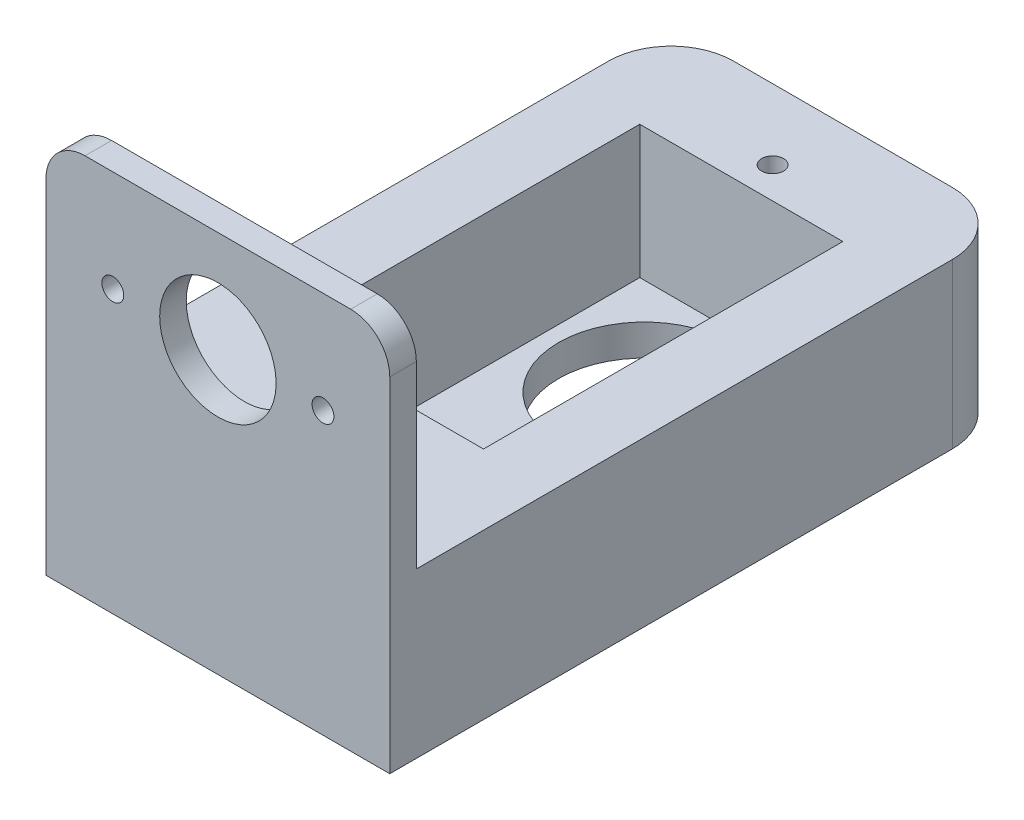
from build123d import *

# Parameters (mm, degrees)
SKETCH1_W           = 22
SKETCH1_H           = 40
BOSS_EXTRUDE1_DEPTH = 10.5
SKETCH2_W           = 13
SKETCH2_H           = 23
CUT_EXTRUDE1_DEPTH  = 8.5
SKETCH3_R           = 5.5
CUT_EXTRUDE2_DEPTH  = 47.435439053
SKETCH4_W           = 22
SKETCH4_H           = 1.7
BOSS_EXTRUDE2_DEPTH = 14
SKETCH5_R           = 3.725
CUT_EXTRUDE3_DEPTH  = 51.508811113
SKETCH5_3_R         = 3.725
SKETCH5_3_R_2       = 0.7
CUT_EXTRUDE4_DEPTH  = 10
SKETCH6_R           = 0.7
CUT_EXTRUDE5_DEPTH  = 2.5
FILLET1_R           = 4
FILLET2_R           = 2.5


with BuildPart() as part:
    # Sketch1 → Boss-Extrude1 (new body)
    with BuildSketch(Plane(origin=(0, 0, 0), x_dir=(1, 0, 0), z_dir=(0, 1, 0))):
        with Locations((11, 20)):
            Rectangle(SKETCH1_W, SKETCH1_H)
    extrude(amount=BOSS_EXTRUDE1_DEPTH)

    # Sketch2 → Cut-Extrude1 (cut)
    with BuildSketch(Plane(origin=(0, 10.5, 0), x_dir=(1, 0, 0), z_dir=(0, 1, 0))):
        with Locations((11, 22)):
            Rectangle(SKETCH2_W, SKETCH2_H)
    extrude(amount=-CUT_EXTRUDE1_DEPTH, mode=Mode.SUBTRACT)

    # Sketch3 → Cut-Extrude2 (cut, through all)
    with BuildSketch(Plane(origin=(0, 2, 0), x_dir=(1, 0, 0), z_dir=(0, 1, 0))):
        with Locations((11, 27.3)):
            Circle(SKETCH3_R)
    extrude(amount=-CUT_EXTRUDE2_DEPTH, mode=Mode.SUBTRACT)

    # Sketch4 → Boss-Extrude2 (add)
    with BuildSketch(Plane(origin=(0, 10.5, 0), x_dir=(1, 0, 0), z_dir=(0, 1, 0))):
        with Locations((11, 0.85)):
            Rectangle(SKETCH4_W, SKETCH4_H)
    extrude(amount=BOSS_EXTRUDE2_DEPTH)

    # Sketch5 → Cut-Extrude3 (cut, through all)
    with BuildSketch(Plane(origin=(0, 0, -1.7), x_dir=(-1, 0, 0), z_dir=(0, 0, -1))):
        with Locations((-11, 18)):
            Circle(SKETCH5_R)
    extrude(amount=-CUT_EXTRUDE3_DEPTH, mode=Mode.SUBTRACT)

    # Sketch5<3> → Cut-Extrude4 (cut)
    with BuildSketch(Plane(origin=(0, 0, -1.7), x_dir=(-1, 0, 0), z_dir=(0, 0, -1))):
        with Locations((-11, 18)):
            Circle(SKETCH5_3_R)
        with Locations((-17.725, 18)):
            Circle(SKETCH5_3_R_2)
        with Locations((-4.275, 18)):
            Circle(SKETCH5_3_R_2)
    extrude(amount=-CUT_EXTRUDE4_DEPTH, mode=Mode.SUBTRACT)

    # Sketch6 → Cut-Extrude5 (cut)
    with BuildSketch(Plane(origin=(0, 10.5, 0), x_dir=(1, 0, 0), z_dir=(0, 1, 0))):
        with Locations((11, 35.5)):
            Circle(SKETCH6_R)
        with Locations((11, 7.5)):
            Circle(SKETCH6_R)
    extrude(amount=-CUT_EXTRUDE5_DEPTH, mode=Mode.SUBTRACT)

    # Fillet1
    fillet1_edges = [part.edges().sort_by_distance(p)[0] for p in [
        (0, 5.25, -40),
        (22, 5.25, -40),
    ]]
    fillet(fillet1_edges, radius=FILLET1_R)

    # Fillet2
    fillet2_edges = [part.edges().sort_by_distance(p)[0] for p in [
        (0, 24.5, -0.85),
        (22, 24.5, -0.85),
    ]]
    fillet(fillet2_edges, radius=FILLET2_R)


solid = part.part
